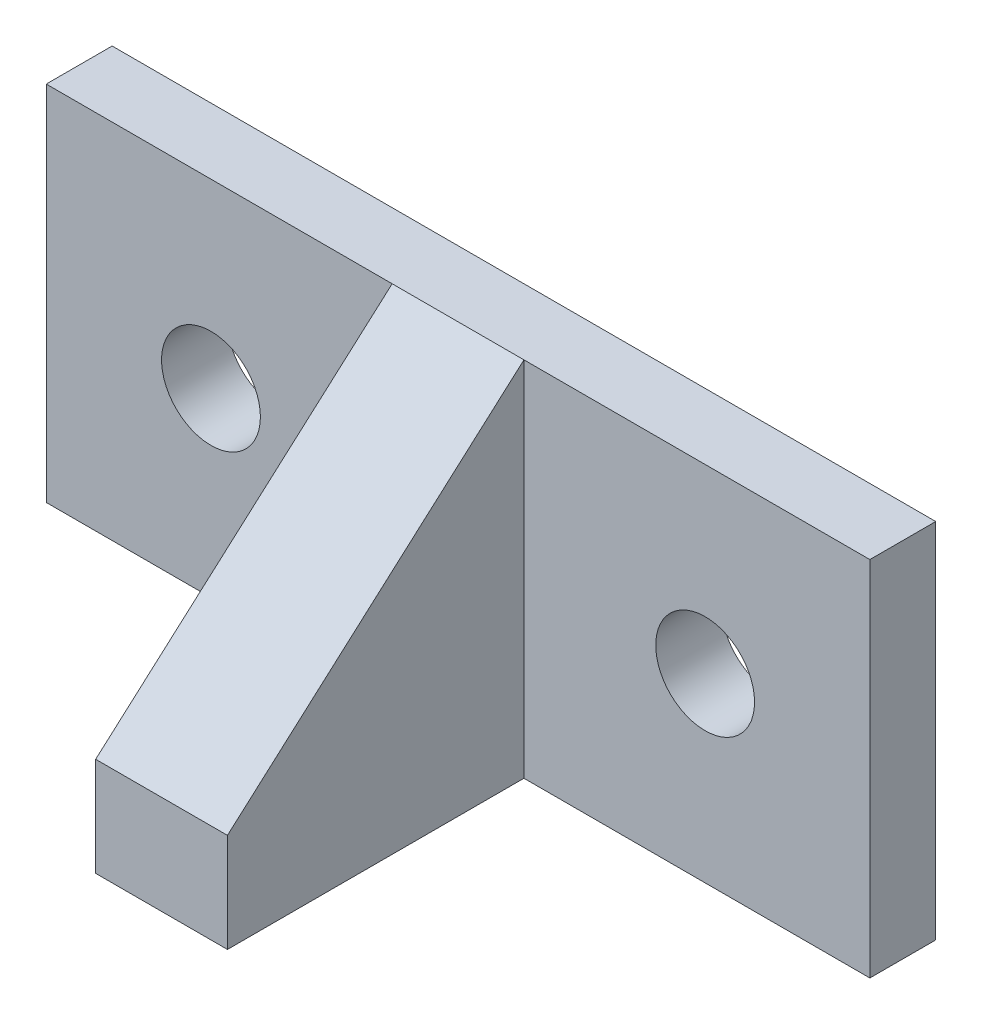
from build123d import *

# Parameters (mm, degrees)
SZKIC1_W                    = 125
SZKIC1_H                    = 55
SZKIC1_R                    = 7.5
DODANIE_WYCI_GNI_CIE1_DEPTH = 10
SZKIC2_W                    = 20
SZKIC2_H                    = 55
DODANIE_WYCI_GNI_CIE2_DEPTH = 45
WYTNIJ_WYCI_GNI_CIE1_DEPTH  = 45


with BuildPart() as part:
    # Szkic1 → Dodanie-wyciągnięcie1 (new body)
    with BuildSketch(Plane.XY):
        Rectangle(SZKIC1_W, SZKIC1_H)
        with Locations((-37.5, 0)):
            Circle(SZKIC1_R, mode=Mode.SUBTRACT)
        with Locations((37.5, 0)):
            Circle(SZKIC1_R, mode=Mode.SUBTRACT)
    extrude(amount=DODANIE_WYCI_GNI_CIE1_DEPTH)

    # Szkic2 → Dodanie-wyciągnięcie2 (add)
    with BuildSketch(Plane.XY.offset(10)):
        Rectangle(SZKIC2_W, SZKIC2_H)
    extrude(amount=DODANIE_WYCI_GNI_CIE2_DEPTH)

    # Szkic3 → Wytnij-wyciągnięcie1 (cut)
    with BuildSketch(Plane(origin=(10, 0, 0), x_dir=(0, 0, -1), z_dir=(1, 0, 0))):
        Polygon((-55, -12.5), (-10, 27.5), (-55, 27.5), align=None)
    extrude(amount=-WYTNIJ_WYCI_GNI_CIE1_DEPTH, mode=Mode.SUBTRACT)


solid = part.part
